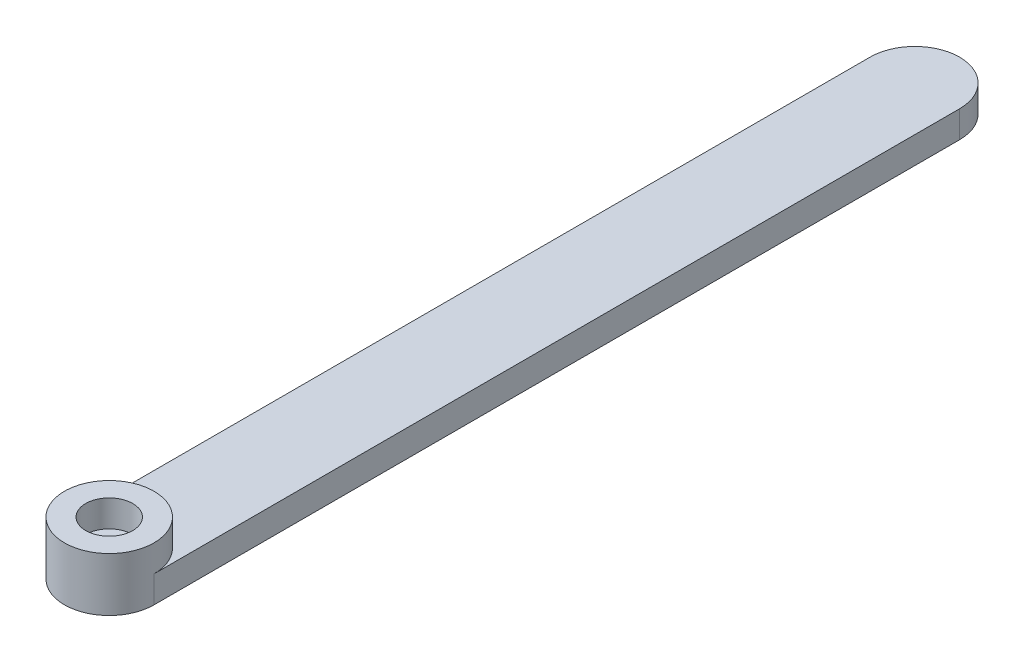
from build123d import *

# Parameters (mm, degrees)
CROQUIS1_R              = 1.15
SALIENTE_EXTRUIR1_DEPTH = 3
CROQUIS2_R              = 5
CROQUIS2_R_2            = 2.625
SALIENTE_EXTRUIR2_DEPTH = 3


with BuildPart() as part:
    # Croquis1 → Saliente-Extruir1 (new body)
    with BuildSketch(Plane(origin=(0, 0, 0), x_dir=(1, 0, 0), z_dir=(0, 1, 0))):
        with BuildLine():
            Line((-5, 0), (-5, 90))
            ThreePointArc((-5, 90), (0, 95), (5, 90))
            Line((5, 90), (5, 0))
            ThreePointArc((5, 0), (0, -5), (-5, 0))
        make_face()
        with Locations(Location((0, 0, 0), (0, 0, 270))):
            Circle(CROQUIS1_R, mode=Mode.SUBTRACT)
    extrude(amount=SALIENTE_EXTRUIR1_DEPTH)

    # Croquis2 → Saliente-Extruir2 (add)
    with BuildSketch(Plane(origin=(0, 3, 0), x_dir=(1, 0, 0), z_dir=(0, 1, 0))):
        Circle(CROQUIS2_R)
        with Locations(Location((0, 0, 0), (0, 0, 270))):
            Circle(CROQUIS2_R_2, mode=Mode.SUBTRACT)
    extrude(amount=SALIENTE_EXTRUIR2_DEPTH)


solid = part.part
